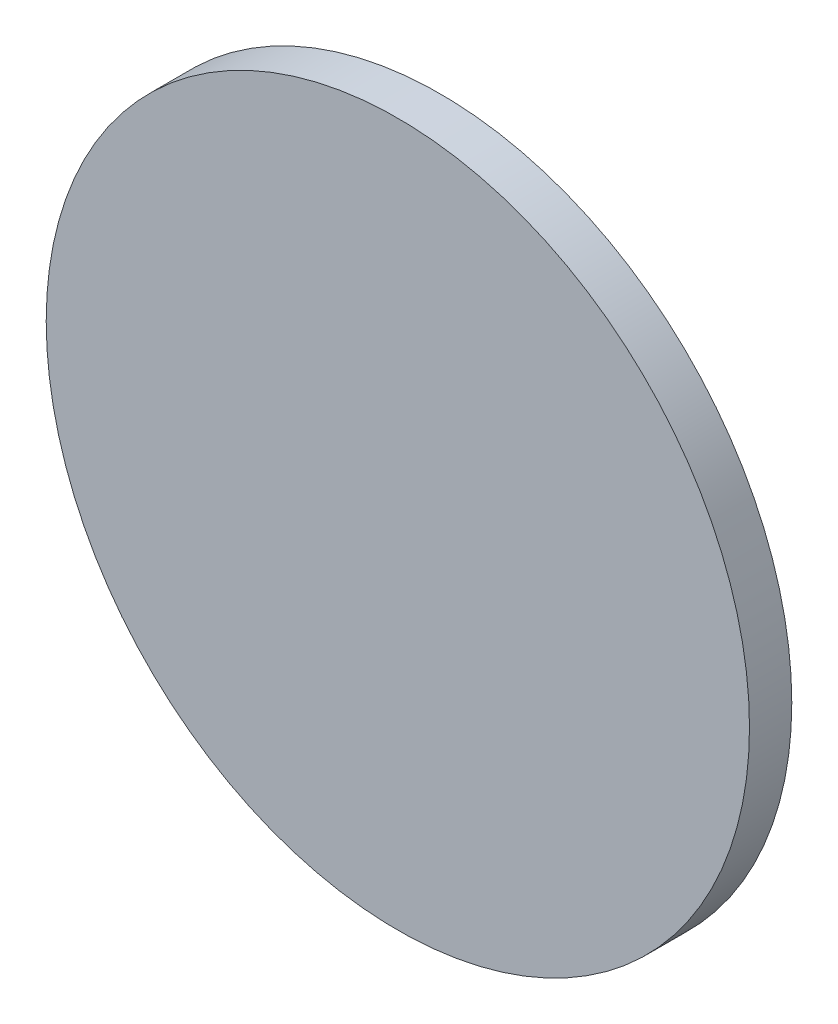
from build123d import *

# Parameters (mm, degrees)
SKETCH_1_R      = 24.9346171
EXTRUDE_1_DEPTH = 3


with BuildPart() as part:
    # 草图1 → 凸台-拉伸1 (new body)
    with BuildSketch(Plane.XY):
        with Locations((-0.364847958, -188.000481983)):
            Circle(SKETCH_1_R)
    extrude(amount=EXTRUDE_1_DEPTH)


solid = part.part
